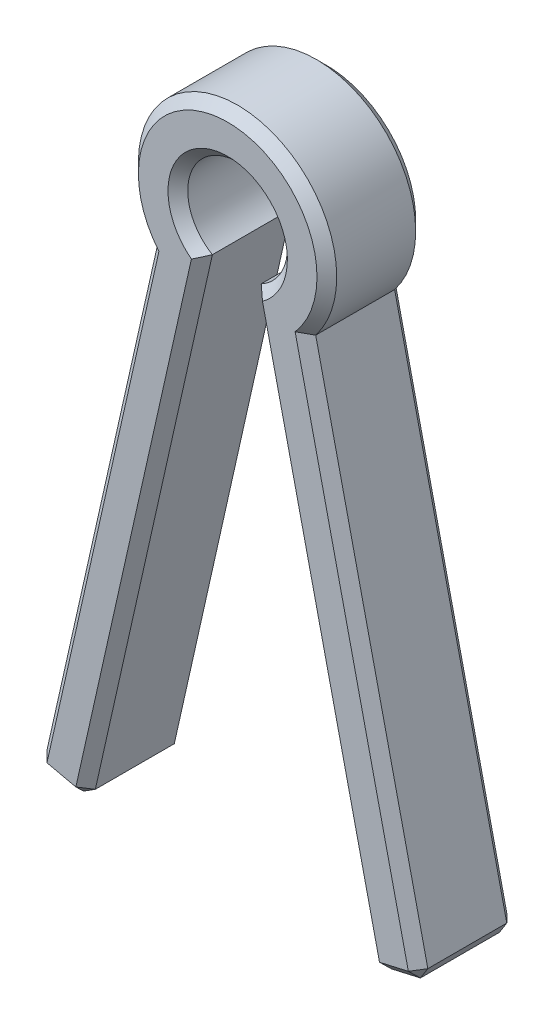
from build123d import *

# Parameters (mm, degrees)
EXTRUDE_1_DEPTH = 10
CHAMFER_1_SIZE  = 1


with BuildPart() as part:
    # 草图1 → 拉伸-薄壁1 (new body)
    with BuildSketch(Plane.XY):
        with BuildLine():
            Line((14.631143099, -58.188741623), (2.394484263, -4.446228189))
            ThreePointArc((2.394484263, -4.446228189), (0.089779865, 5.049201875), (-2.551037445, -4.358291862))
            Line((-2.551037445, -4.358291862), (-14.631143099, -58.188741623))
            Line((-14.631143099, -58.188741623), (-19.509807266, -57.09391929))
            Line((-19.509807266, -57.09391929), (-8.04810956, -6.019172079))
            ThreePointArc((-8.04810956, -6.019172079), (0.106256457, 10.049438271), (7.919038593, -6.187998688))
            Line((7.919038593, -6.187998688), (19.506366852, -57.078699572))
            Line((19.506366852, -57.078699572), (14.631143099, -58.188741623))
        make_face()
    extrude(amount=EXTRUDE_1_DEPTH)

    # 倒角1
    chamfer_1_edges = [part.edges().sort_by_distance(p)[0] for p in [
        (19.506366852, -57.078699572, 5),
        (14.631143099, -58.188741623, 5),
        (-14.631143099, -58.188741623, 5),
        (-8.591090272, -31.273516742, 10),
        (-19.509807266, -57.09391929, 5),
        (0.089779865, 5.049201875, 10),
        (8.512813681, -31.317484906, 10),
        (17.068754976, -57.633720597, 10),
        (13.712702723, -31.63334913, 10),
        (0.106256457, 10.049438271, 10),
        (-13.778958413, -31.556545684, 10),
        (0.106256457, 10.049438271, 0),
        (13.712702723, -31.63334913, 0),
        (17.068754976, -57.633720597, 0),
        (8.512813681, -31.317484906, 0),
        (0.089779865, 5.049201875, 0),
        (-17.070475183, -57.641330456, 10),
        (-8.591090272, -31.273516742, 0),
        (-17.070475183, -57.641330456, 0),
        (-13.778958413, -31.556545684, 0),
    ]]
    chamfer(chamfer_1_edges, length=CHAMFER_1_SIZE)


solid = part.part
